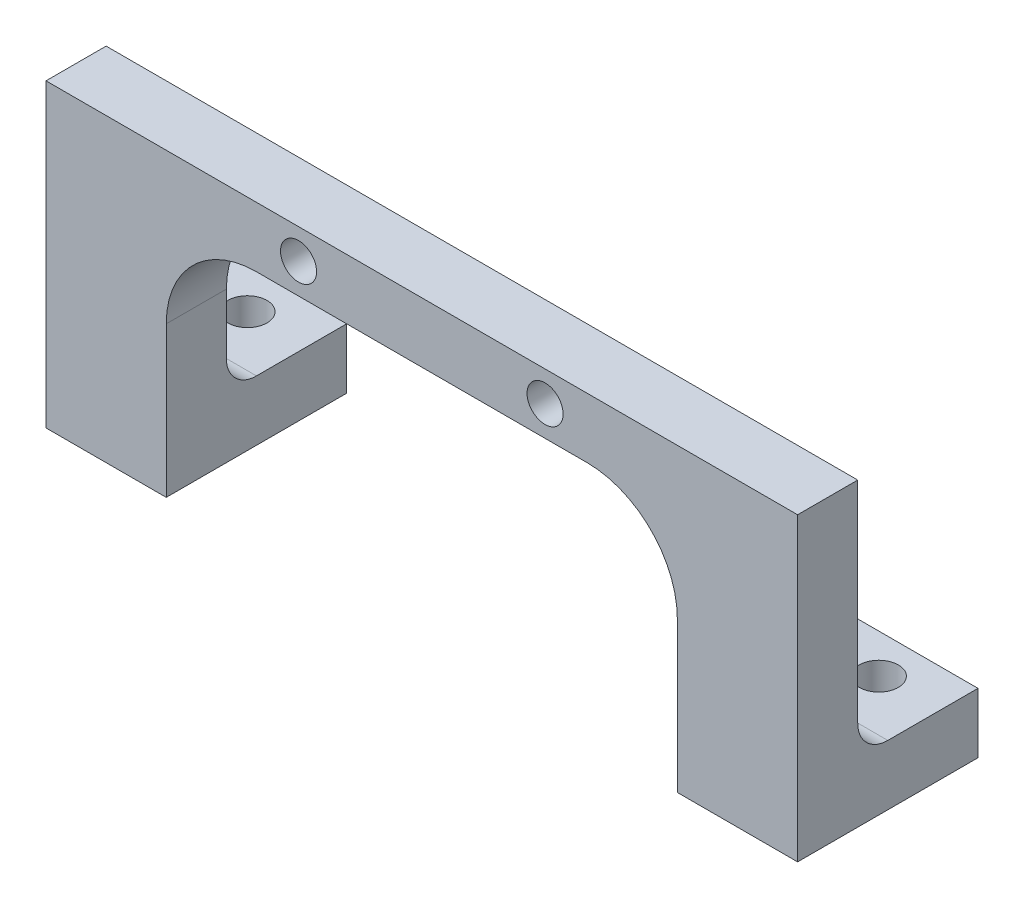
from build123d import *

# Parameters (mm, degrees)
BOSS_EXTRUDE1_DEPTH = 63.5
SKETCH2_R           = 1.524
CUT_EXTRUDE1_DEPTH  = 67.526668337
SKETCH3_R           = 1.651
CUT_EXTRUDE2_DEPTH  = 69.314377924


with BuildPart() as part:
    # Sketch1 → Boss-Extrude1 (new body)
    with BuildSketch(Plane(origin=(0, 0, 0), x_dir=(0, 0, -1), z_dir=(1, 0, 0))):
        with BuildLine():
            Line((7.269655172, -7.62), (14.889655172, -7.62))
            Line((14.889655172, -7.62), (14.889655172, -12.7))
            Line((14.889655172, -12.7), (-0.350344828, -12.7))
            Line((-0.350344828, -12.7), (-0.350344828, 12.7))
            Line((-0.350344828, 12.7), (4.729655172, 12.7))
            Line((4.729655172, 12.7), (4.729655172, -5.08))
            ThreePointArc((4.729655172, -5.08), (5.473603948, -6.876051224), (7.269655172, -7.62))
        make_face()
    extrude(amount=BOSS_EXTRUDE1_DEPTH)

    # Sketch2 → Cut-Extrude1 (cut, through all)
    with BuildSketch(Plane.XY.offset(0.350344828)):
        with Locations((21.336, 10.16)):
            Circle(SKETCH2_R)
        with Locations((42.164, 10.16)):
            Circle(SKETCH2_R)
        with BuildLine():
            Line((10.16, 0), (10.16, -12.7))
            Line((10.16, -12.7), (53.34, -12.7))
            Line((53.34, -12.7), (53.34, 0))
            ThreePointArc((53.34, 0), (51.108153673, 5.388153673), (45.72, 7.62))
            Line((45.72, 7.62), (17.78, 7.62))
            ThreePointArc((17.78, 7.62), (12.391846327, 5.388153673), (10.16, 0))
        make_face()
    extrude(amount=-CUT_EXTRUDE1_DEPTH, mode=Mode.SUBTRACT)

    # Sketch3 → Cut-Extrude2 (cut, through all)
    with BuildSketch(Plane(origin=(0, -7.62, 0), x_dir=(1, 0, 0), z_dir=(0, 1, 0))):
        with Locations(Location((5.08, 11.587655172, 0), (0, 0, 270))):
            Circle(SKETCH3_R)
        with Locations(Location((58.42, 11.587655172, 0), (0, 0, 270))):
            Circle(SKETCH3_R)
    extrude(amount=-CUT_EXTRUDE2_DEPTH, mode=Mode.SUBTRACT)


solid = part.part
